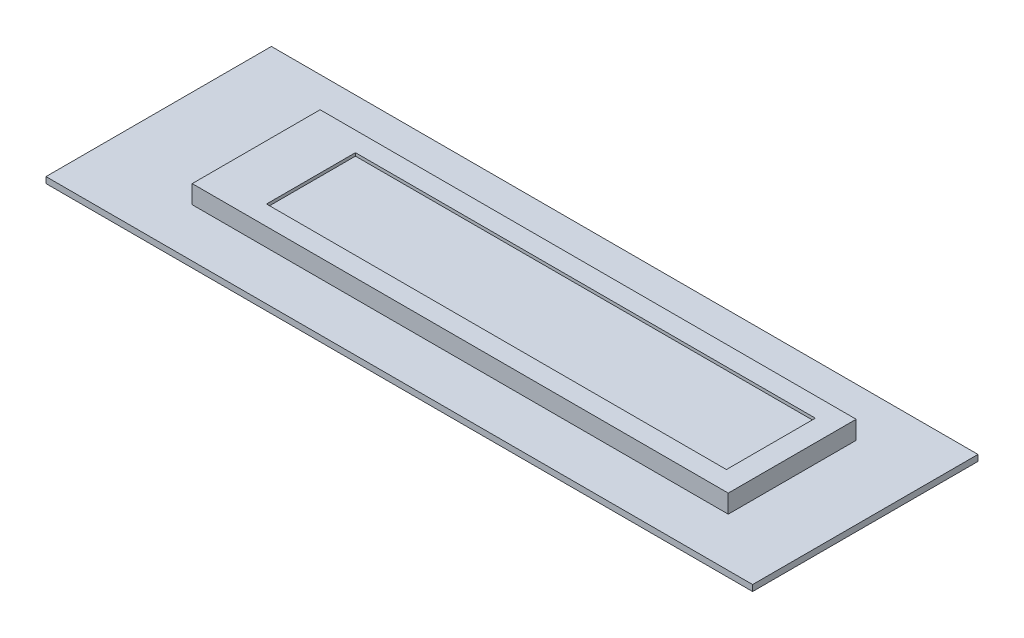
from build123d import *

# Parameters (mm, degrees)
SKETCH1_W           = 116
SKETCH1_H           = 37
BOSS_EXTRUDE1_DEPTH = 1
SKETCH2_W           = 88
SKETCH2_H           = 21
BOSS_EXTRUDE2_DEPTH = 3
SKETCH3_W           = 75.5
SKETCH3_H           = 14.6
CUT_EXTRUDE1_DEPTH  = 0.5


with BuildPart() as part:
    # Sketch1 → Boss-Extrude1 (new body)
    with BuildSketch(Plane(origin=(0, 0, 0), x_dir=(1, 0, 0), z_dir=(0, 1, 0))):
        Rectangle(SKETCH1_W, SKETCH1_H)
    extrude(amount=BOSS_EXTRUDE1_DEPTH)

    # Sketch2 → Boss-Extrude2 (add)
    with BuildSketch(Plane(origin=(0, 1, 0), x_dir=(1, 0, 0), z_dir=(0, 1, 0))):
        with Locations((2, 0)):
            Rectangle(SKETCH2_W, SKETCH2_H)
    extrude(amount=BOSS_EXTRUDE2_DEPTH)

    # Sketch3 → Cut-Extrude1 (cut)
    with BuildSketch(Plane(origin=(0, 4, 0), x_dir=(1, 0, 0), z_dir=(0, 1, 0))):
        with Locations((4.75, 0)):
            Rectangle(SKETCH3_W, SKETCH3_H)
    extrude(amount=-CUT_EXTRUDE1_DEPTH, mode=Mode.SUBTRACT)


solid = part.part
